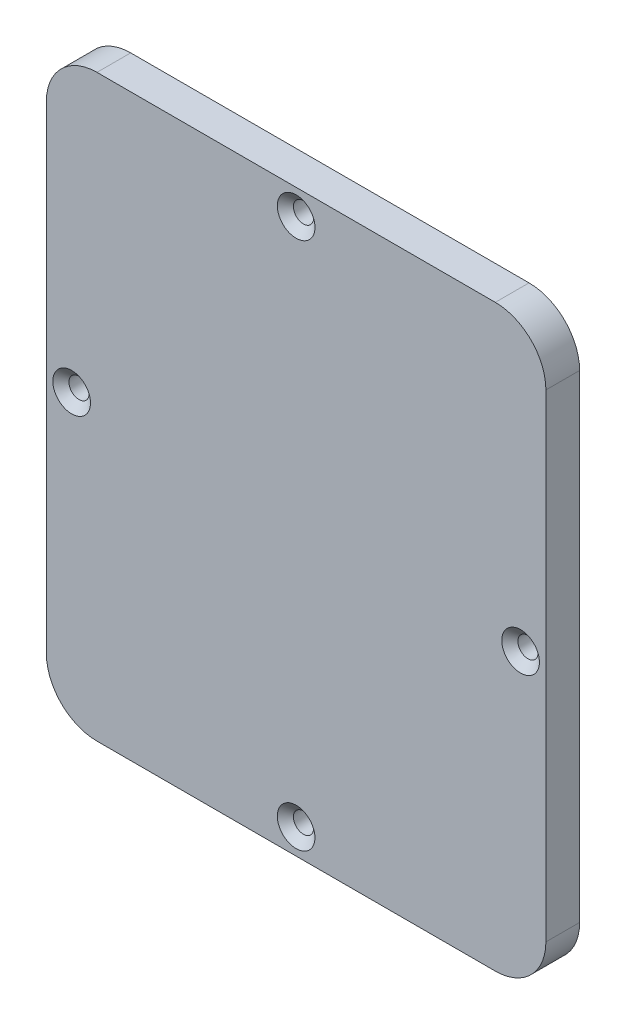
from build123d import *

# Parameters (mm, degrees)
SKETCH1_R                                         = 1.5875
BOSS_EXTRUDE1_DEPTH                               = 6.35
CSK_FOR_6_FLAT_HEAD_MACHINE_SCREW_100_D           = 3.7973
CSK_FOR_6_FLAT_HEAD_MACHINE_SCREW_100_CSINK_D     = 7.0866
CSK_FOR_6_FLAT_HEAD_MACHINE_SCREW_100_CSINK_ANGLE = 100


with BuildPart() as part:
    # Sketch1 → Boss-Extrude1 (new body)
    with BuildSketch(Plane.XY):
        with BuildLine():
            Line((3.175, -6.35), (78.175000114, -6.35))
            ThreePointArc((78.175000114, -6.35), (84.910192205, -3.560192091), (87.700000114, 3.175))
            Line((87.700000114, 3.175), (87.700000114, 93.175000086))
            ThreePointArc((87.700000114, 93.175000086), (84.910192205, 99.910192177), (78.175000114, 102.700000086))
            Line((78.175000114, 102.700000086), (3.175, 102.700000086))
            ThreePointArc((3.175, 102.700000086), (-3.560192091, 99.910192177), (-6.35, 93.175000086))
            Line((-6.35, 93.175000086), (-6.35, 3.175))
            ThreePointArc((-6.35, 3.175), (-3.560192091, -3.560192091), (3.175, -6.35))
        make_face()
        with Locations((-1.5875, 48.175000043)):
            Circle(SKETCH1_R, mode=Mode.SUBTRACT)
        with Locations((40.675000057, -1.5875)):
            Circle(SKETCH1_R, mode=Mode.SUBTRACT)
        with Locations((82.937500114, 48.175000043)):
            Circle(SKETCH1_R, mode=Mode.SUBTRACT)
        with Locations((40.675000057, 97.937500086)):
            Circle(SKETCH1_R, mode=Mode.SUBTRACT)
    extrude(amount=BOSS_EXTRUDE1_DEPTH)

    # CSK for #6 Flat Head Machine Screw (100)1 (through all)
    with Locations(Plane.XY.offset(6.35)):
        with Locations((82.937500114, 48.175000043), (-1.5875, 48.175000043), (40.675000057, -1.5875), (40.675000057, 97.937500086)):
            CounterSinkHole(CSK_FOR_6_FLAT_HEAD_MACHINE_SCREW_100_D / 2, CSK_FOR_6_FLAT_HEAD_MACHINE_SCREW_100_CSINK_D / 2, counter_sink_angle=CSK_FOR_6_FLAT_HEAD_MACHINE_SCREW_100_CSINK_ANGLE)


solid = part.part
